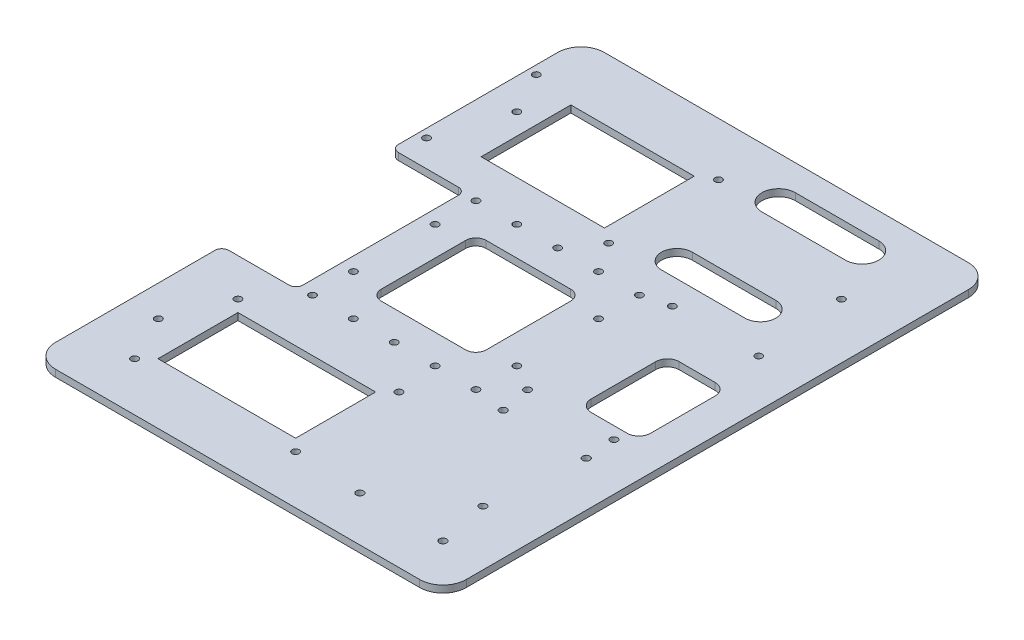
from build123d import *

# Parameters (mm, degrees)
SKETCH_2_R          = 1.5
SKETCH_2_R_2        = 1.55
SKETCH_2_W          = 58.95
SKETCH_2_H          = 34.26
SKETCH_2_W_2        = 25.458045559
SKETCH_2_H_2        = 37.682827862
SKETCH_2_W_3        = 52.836453453
SKETCH_2_H_3        = 38.433812924
EXTRUDE_2_DEPTH     = 3
FILLET_2_R          = 3
FILLET_3_R          = 5
CUT_EXTRUDE_1_DEPTH = 157.537629335


with BuildPart() as part:
    # 草图2 → 凸台-拉伸2 (new body)
    with BuildSketch(Plane(origin=(0, 0, 0), x_dir=(1, 0, 0), z_dir=(0, 1, 0))):
        with BuildLine():
            Line((-72.5, -36.293945631), (-72.5, -107.5))
            ThreePointArc((-72.5, -107.5), (-69.571067812, -114.571067812), (-62.5, -117.5))
            Line((-62.5, -117.5), (93.386553273, -117.5))
            ThreePointArc((93.386553273, -117.5), (100.457621085, -114.571067812), (103.386553273, -107.5))
            Line((103.386553273, -107.5), (103.386553273, 107.5))
            ThreePointArc((103.386553273, 107.5), (100.457621085, 114.571067812), (93.386553273, 117.5))
            Line((93.386553273, 117.5), (-62.5, 117.5))
            ThreePointArc((-62.5, 117.5), (-69.571067812, 114.571067812), (-72.5, 107.5))
            Line((-72.5, 107.5), (-72.5, 36.293945631))
            Line((-72.5, 36.293945631), (-40.778460838, 36.293945631))
            Line((-40.778460838, 36.293945631), (-40.778460838, -36.293945631))
            Line((-40.778460838, -36.293945631), (-72.5, -36.293945631))
        make_face()
        with Locations(Location((-35, 35, 0), (0, 0, 270))):
            Circle(SKETCH_2_R, mode=Mode.SUBTRACT)
        with Locations(Location((35, 35, 0), (0, 0, 90))):
            Circle(SKETCH_2_R, mode=Mode.SUBTRACT)
        with Locations(Location((35, -35, 0), (0, 0, 270))):
            Circle(SKETCH_2_R, mode=Mode.SUBTRACT)
        with Locations(Location((-35, -35, 0), (0, 0, 90))):
            Circle(SKETCH_2_R, mode=Mode.SUBTRACT)
        with Locations(Location((-17.5, 35, 0), (0, 0, 270))):
            Circle(SKETCH_2_R, mode=Mode.SUBTRACT)
        with Locations(Location((17.5, 35, 0), (0, 0, 90))):
            Circle(SKETCH_2_R, mode=Mode.SUBTRACT)
        with Locations(Location((-17.5, -35, 0), (0, 0, 90))):
            Circle(SKETCH_2_R, mode=Mode.SUBTRACT)
        with Locations(Location((17.5, -35, 0), (0, 0, 270))):
            Circle(SKETCH_2_R, mode=Mode.SUBTRACT)
        with Locations(Location((-35, 17.5, 0), (0, 0, 270))):
            Circle(SKETCH_2_R, mode=Mode.SUBTRACT)
        with Locations(Location((-35, -17.5, 0), (0, 0, 90))):
            Circle(SKETCH_2_R, mode=Mode.SUBTRACT)
        with Locations(Location((35, -17.5, 0), (0, 0, 270))):
            Circle(SKETCH_2_R, mode=Mode.SUBTRACT)
        with Locations(Location((35, 17.5, 0), (0, 0, 90))):
            Circle(SKETCH_2_R, mode=Mode.SUBTRACT)
        with Locations(Location((0, 35, 0), (0, 0, 270))):
            Circle(SKETCH_2_R, mode=Mode.SUBTRACT)
        with Locations(Location((0, -35, 0), (0, 0, 270))):
            Circle(SKETCH_2_R, mode=Mode.SUBTRACT)
        with Locations(Location((-49.509707517, -52.404109444, 0), (0, 0, 270))):
            Circle(SKETCH_2_R, mode=Mode.SUBTRACT)
        with Locations(Location((-49.509707517, -96.664109444, 0), (0, 0, 270))):
            Circle(SKETCH_2_R, mode=Mode.SUBTRACT)
        with Locations(Location((19.440292483, -52.404109444, 0), (0, 0, 270))):
            Circle(SKETCH_2_R, mode=Mode.SUBTRACT)
        with Locations(Location((19.440292483, -96.664109444, 0), (0, 0, 270))):
            Circle(SKETCH_2_R, mode=Mode.SUBTRACT)
        with Locations(Location((-59.25, -76.75, 0), (0, 0, 270))):
            Circle(SKETCH_2_R, mode=Mode.SUBTRACT)
        with Locations(Location((79.75, -76.75, 0), (0, 0, 270))):
            Circle(SKETCH_2_R, mode=Mode.SUBTRACT)
        with Locations(Location((79.75, 76.75, 0), (0, 0, 270))):
            Circle(SKETCH_2_R, mode=Mode.SUBTRACT)
        with Locations(Location((-59.25, 76.75, 0), (0, 0, 270))):
            Circle(SKETCH_2_R, mode=Mode.SUBTRACT)
        with Locations(Location((-68.87108956, 94.711076741, 0), (0, 0, 270))):
            Circle(SKETCH_2_R, mode=Mode.SUBTRACT)
        with Locations(Location((-68.87108956, 47.711076741, 0), (0, 0, 270))):
            Circle(SKETCH_2_R, mode=Mode.SUBTRACT)
        with Locations(Location((9.12891044, 47.711076741, 0), (0, 0, 270))):
            Circle(SKETCH_2_R, mode=Mode.SUBTRACT)
        with Locations(Location((9.12891044, 94.711076741, 0), (0, 0, 270))):
            Circle(SKETCH_2_R, mode=Mode.SUBTRACT)
        with Locations(Location((48.531405595, -36.854109444, 0), (0, 0, 270))):
            Circle(SKETCH_2_R_2, mode=Mode.SUBTRACT)
        with Locations(Location((84.091405595, -36.854109444, 0), (0, 0, 270))):
            Circle(SKETCH_2_R_2, mode=Mode.SUBTRACT)
        with Locations(Location((48.531405595, -98.234109444, 0), (0, 0, 270))):
            Circle(SKETCH_2_R_2, mode=Mode.SUBTRACT)
        with Locations(Location((84.091405595, -98.234109444, 0), (0, 0, 270))):
            Circle(SKETCH_2_R_2, mode=Mode.SUBTRACT)
        with Locations(Location((46.131405595, 37.969626598, 0), (0, 0, 270))):
            Circle(SKETCH_2_R, mode=Mode.SUBTRACT)
        with Locations(Location((83.131405595, 37.969626598, 0), (0, 0, 270))):
            Circle(SKETCH_2_R, mode=Mode.SUBTRACT)
        with Locations(Location((46.131405595, -24.030373402, 0), (0, 0, 270))):
            Circle(SKETCH_2_R, mode=Mode.SUBTRACT)
        with Locations(Location((83.131405595, -24.030373402, 0), (0, 0, 270))):
            Circle(SKETCH_2_R, mode=Mode.SUBTRACT)
        with BuildLine():
            Line((-18.1, 22.5), (18.1, 22.5))
            ThreePointArc((18.1, 22.5), (21.211269837, 21.211269837), (22.5, 18.1))
            Line((22.5, 18.1), (22.5, -18.1))
            ThreePointArc((22.5, -18.1), (21.211269837, -21.211269837), (18.1, -22.5))
            Line((18.1, -22.5), (-18.1, -22.5))
            ThreePointArc((-18.1, -22.5), (-21.211269837, -21.211269837), (-22.5, -18.1))
            Line((-22.5, -18.1), (-22.5, 18.1))
            ThreePointArc((-22.5, 18.1), (-21.211269837, 21.211269837), (-18.1, 22.5))
        make_face(mode=Mode.SUBTRACT)
        with Locations((-15.034707517, -74.534109444)):
            Rectangle(SKETCH_2_W, SKETCH_2_H, mode=Mode.SUBTRACT)
        with Locations((75.885013297, 0)):
            Rectangle(SKETCH_2_W_2, SKETCH_2_H_2, mode=Mode.SUBTRACT)
        with Locations((-23.799399193, 71.645143509)):
            Rectangle(SKETCH_2_W_3, SKETCH_2_H_3, mode=Mode.SUBTRACT)
    extrude(amount=EXTRUDE_2_DEPTH)

    # 圆角2
    fillet_2_edges = [part.edges().sort_by_distance(p)[0] for p in [
        (-72.5, 1.5, 36.293945631),
        (-40.778460838, 1.5, 36.293945631),
        (-40.778460838, 1.5, -36.293945631),
        (-72.5, 1.5, -36.293945631),
    ]]
    fillet(fillet_2_edges, radius=FILLET_2_R)

    # 圆角3
    fillet_3_edges = [part.edges().sort_by_distance(p)[0] for p in [
        (88.614036076, 1.5, 18.841413931),
        (88.614036076, 1.5, -18.841413931),
        (63.155990517, 1.5, -18.841413931),
        (63.155990517, 1.5, 18.841413931),
    ]]
    fillet(fillet_3_edges, radius=FILLET_3_R)

    # 草图3 → 切除-拉伸1 (cut, through all)
    with BuildSketch(Plane(origin=(0, 3, 0), x_dir=(1, 0, 0), z_dir=(0, 1, 0))):
        with BuildLine():
            Line((30.380318315, 106.392706566), (66.1383582, 106.392706566))
            ThreePointArc((66.1383582, 106.392706566), (73.287559025, 99.243505741), (66.1383582, 92.094304917))
            Line((66.1383582, 92.094304917), (30.380318315, 92.094304917))
            ThreePointArc((30.380318315, 92.094304917), (23.23111749, 99.243505741), (30.380318315, 106.392706566))
        make_face()
        with BuildLine():
            Line((30.380318315, 62.274503657), (66.1383582, 62.274503657))
            ThreePointArc((66.1383582, 62.274503657), (72.736553362, 55.676308496), (66.1383582, 49.078113334))
            Line((66.1383582, 49.078113334), (30.380318315, 49.078113334))
            ThreePointArc((30.380318315, 49.078113334), (23.782123153, 55.676308496), (30.380318315, 62.274503657))
        make_face()
    extrude(amount=-CUT_EXTRUDE_1_DEPTH, mode=Mode.SUBTRACT)


solid = part.part
